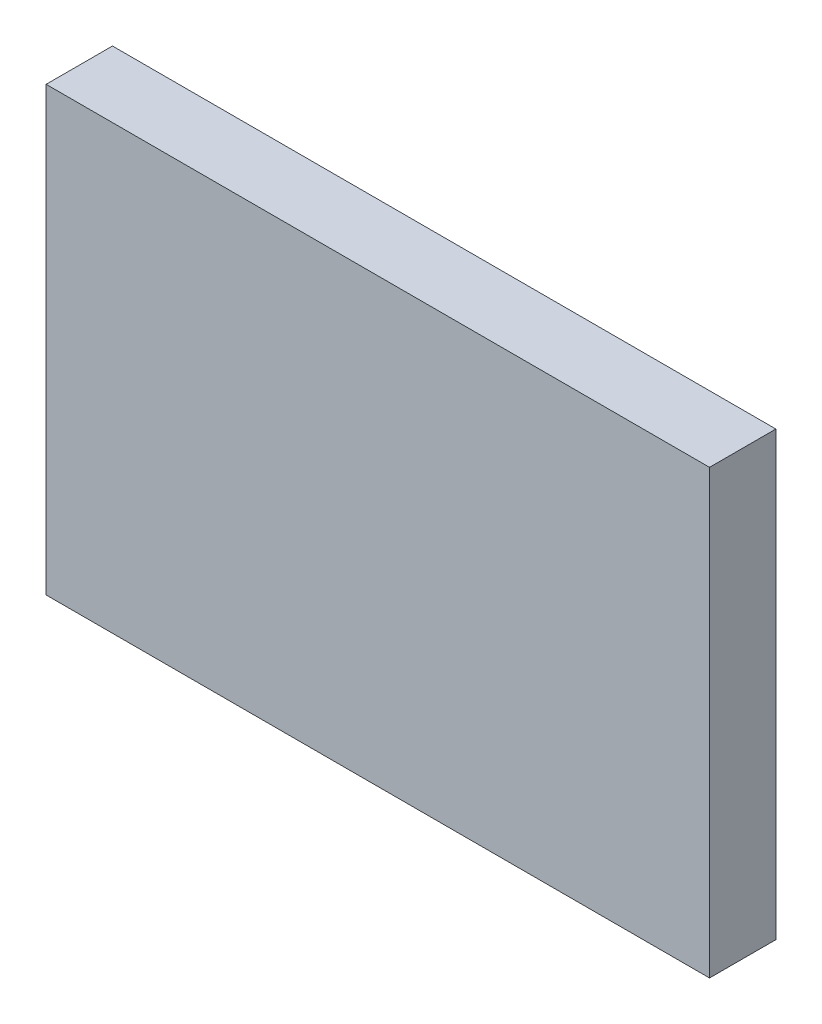
from build123d import *

# Parameters (mm, degrees)
SKETCH1_W           = 60
SKETCH1_H           = 40
BOSS_EXTRUDE1_DEPTH = 6


with BuildPart() as part:
    # Sketch1 → Boss-Extrude1 (new body)
    with BuildSketch(Plane.XY):
        with Locations((30, 20)):
            Rectangle(SKETCH1_W, SKETCH1_H)
    extrude(amount=BOSS_EXTRUDE1_DEPTH)


solid = part.part
